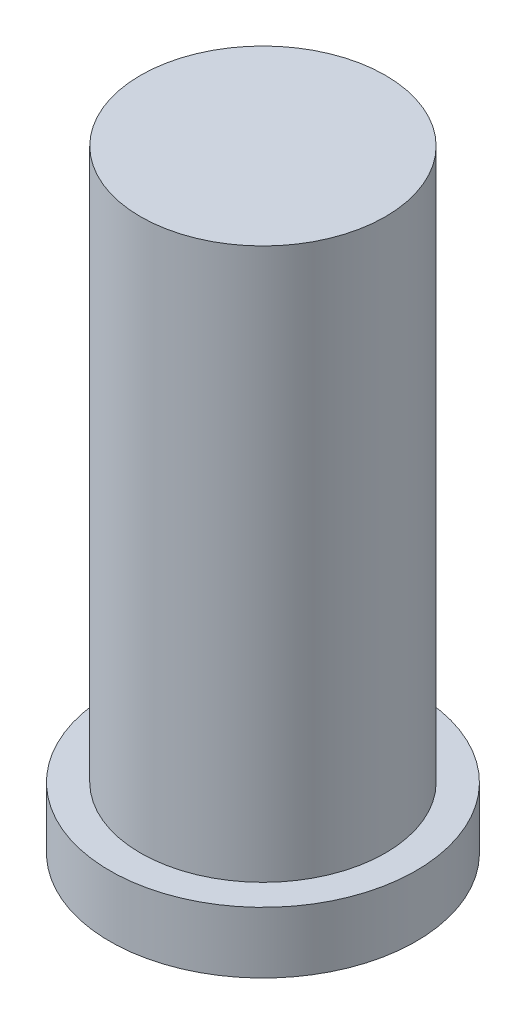
from build123d import *

# Parameters (mm, degrees)
SKETCH1_R           = 4
BOSS_EXTRUDE1_DEPTH = 18
SKETCH2_R           = 5
BOSS_EXTRUDE2_DEPTH = 2


with BuildPart() as part:
    # Sketch1 → Boss-Extrude1 (new body)
    with BuildSketch(Plane(origin=(0, 0, 0), x_dir=(1, 0, 0), z_dir=(0, 1, 0))):
        with Locations(Location((0, 0, 0), (0, 0, 270))):
            Circle(SKETCH1_R)
    extrude(amount=BOSS_EXTRUDE1_DEPTH)

    # Sketch2 → Boss-Extrude2 (add)
    with BuildSketch(Plane(origin=(0, 0, 0), x_dir=(-1, 0, 0), z_dir=(0, -1, 0))):
        with Locations(Location((0, 0, 0), (0, 0, 90))):
            Circle(SKETCH2_R)
    extrude(amount=BOSS_EXTRUDE2_DEPTH)


solid = part.part
